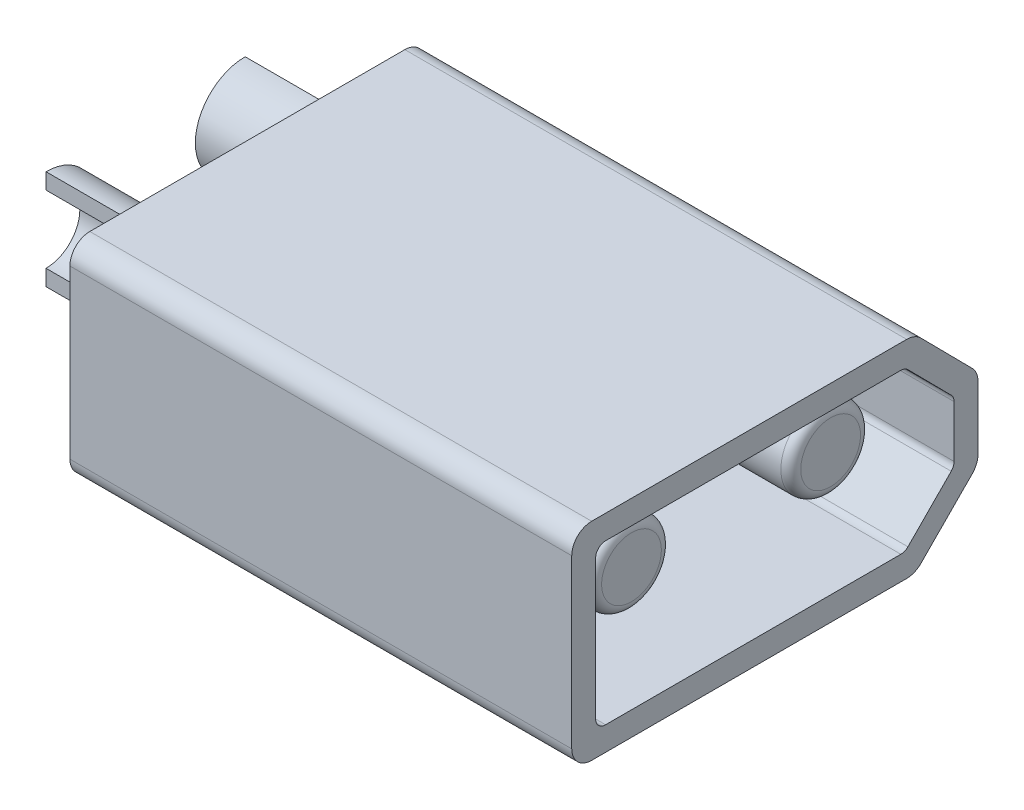
from build123d import *

# Parameters (mm, degrees)
BOSS_EXTRUDE1_DEPTH = 12.6
CUT_EXTRUDE1_DEPTH  = 7
CUT_EXTRUDE2_DEPTH  = 3
SKETCH5_R           = 1
BOSS_EXTRUDE2_DEPTH = 5.9
SKETCH6_R           = 1.25
BOSS_EXTRUDE3_DEPTH = 6.2
SKETCH7_R           = 0.85
CUT_EXTRUDE3_DEPTH  = 4.5
SKETCH8_W           = 3.3
SKETCH8_H           = 2.25
CUT_EXTRUDE4_DEPTH  = 18.024687956
CUT_EXTRUDE5_DEPTH  = 15.941218156
FILLET1_R           = 0.5
FILLET2_R           = 0.25
FILLET3_R           = 0.15
FILLET4_R           = 0.25


with BuildPart() as part:
    # Sketch1 → Boss-Extrude1 (new body)
    with BuildSketch(Plane(origin=(0, 0, 0), x_dir=(0, 0, -1), z_dir=(1, 0, 0))):
        Polygon((0, 0), (8.618070798, 0), (10.2, 1.6), (10.2, 3.6), (8.618070798, 5.2), (0, 5.2), align=None)
    extrude(amount=BOSS_EXTRUDE1_DEPTH)

    # Sketch2 → Cut-Extrude1 (cut)
    with BuildSketch(Plane(origin=(12.6, 0, 0), x_dir=(0, 0, -1), z_dir=(1, 0, 0))):
        Polygon((9.6, 3.353465579), (8.367544249, 4.6), (0.6, 4.6), (0.6, 0.6), (8.367544249, 0.6), (9.6, 1.846534421), align=None)
    extrude(amount=-CUT_EXTRUDE1_DEPTH, mode=Mode.SUBTRACT)

    # Sketch3 → Cut-Extrude2 (cut)
    with BuildSketch(Plane(origin=(0, 0, 0), x_dir=(0, 0, -1), z_dir=(1, 0, 0))):
        Polygon((9.6, 3.353465579), (8.367544249, 4.6), (0.6, 4.6), (0.6, 0.6), (8.367544249, 0.6), (9.6, 1.846534421), align=None)
    extrude(amount=CUT_EXTRUDE2_DEPTH, mode=Mode.SUBTRACT)

    # Sketch5 → Boss-Extrude2 (add)
    with BuildSketch(Plane(origin=(5.6, 0, 0), x_dir=(0, 0, -1), z_dir=(1, 0, 0))):
        with Locations((2.6, 2.6)):
            Circle(SKETCH5_R)
        with Locations((7.6, 2.6)):
            Circle(SKETCH5_R)
    extrude(amount=BOSS_EXTRUDE2_DEPTH)

    # Sketch6 → Boss-Extrude3 (add)
    with BuildSketch(Plane.ZY.offset(-3)):
        with Locations(Location((-7.6, 2.6, 0), (0, 0, 180))):
            Circle(SKETCH6_R)
        with Locations(Location((-2.6, 2.6, 0), (0, 0, 180))):
            Circle(SKETCH6_R)
    extrude(amount=BOSS_EXTRUDE3_DEPTH)

    # Sketch7 → Cut-Extrude3 (cut)
    with BuildSketch(Plane.ZY.offset(3.2)):
        with Locations((-7.6, 2.6)):
            Circle(SKETCH7_R)
        with Locations((-2.6, 2.6)):
            Circle(SKETCH7_R)
    extrude(amount=-CUT_EXTRUDE3_DEPTH, mode=Mode.SUBTRACT)

    # Sketch8 → Cut-Extrude4 (cut, through all)
    with BuildSketch(Plane(origin=(0, 5.2, 0), x_dir=(1, 0, 0), z_dir=(0, 1, 0))):
        with Locations((-2.55, 8.725)):
            Rectangle(SKETCH8_W, SKETCH8_H)
        with Locations((-2.55, 1.475)):
            Rectangle(SKETCH8_W, SKETCH8_H)
    extrude(amount=-CUT_EXTRUDE4_DEPTH, mode=Mode.SUBTRACT)

    # Sketch9 → Cut-Extrude5 (cut, through all)
    with BuildSketch(Plane.ZY.offset(-3)):
        with BuildLine():
            Line((-6.811013308, 4.6), (-3.388986692, 4.6))
            ThreePointArc((-3.388986692, 4.6), (-4.75, 2.6), (-3.388986692, 0.6))
            Line((-3.388986692, 0.6), (-6.811013308, 0.6))
            ThreePointArc((-6.811013308, 0.6), (-5.45, 2.6), (-6.811013308, 4.6))
        make_face()
    extrude(amount=-CUT_EXTRUDE5_DEPTH, mode=Mode.SUBTRACT)

    # Fillet1
    fillet1_edges = [part.edges().sort_by_distance(p)[0] for p in [
        (6.3, 5.2, 0),
        (6.3, 5.2, -8.618070798),
        (6.3, 3.6, -10.2),
        (6.3, 1.6, -10.2),
        (6.3, 0, -8.618070798),
        (6.3, 0, 0),
    ]]
    fillet(fillet1_edges, radius=FILLET1_R)

    # Fillet2
    fillet2_edges = [part.edges().sort_by_distance(p)[0] for p in [
        (9.1, 3.353465579, -9.6),
        (9.1, 1.846534421, -9.6),
        (9.1, 0.6, -8.367544249),
        (9.1, 0.6, -0.6),
        (9.1, 4.6, -0.6),
        (9.1, 4.6, -8.367544249),
        (1.5, 1.846534421, -9.6),
        (1.5, 3.353465579, -9.6),
        (1.5, 4.6, -8.367544249),
        (1.5, 4.6, -0.6),
        (1.5, 0.6, -0.6),
        (1.5, 0.6, -8.367544249),
    ]]
    fillet(fillet2_edges, radius=FILLET2_R)

    # Fillet3
    fillet3_edges = [part.edges().sort_by_distance(p)[0] for p in [
        (4.3, 0.6, -6.811013308),
        (4.3, 4.6, -6.811013308),
        (4.3, 4.6, -3.388986692),
        (4.3, 0.6, -3.388986692),
    ]]
    fillet(fillet3_edges, radius=FILLET3_R)

    # Fillet4
    fillet4_edges = [part.edges().sort_by_distance(p)[0] for p in [
        (11.5, 2.6, -1.6),
        (11.5, 2.6, -6.6),
    ]]
    fillet(fillet4_edges, radius=FILLET4_R)


solid = part.part
